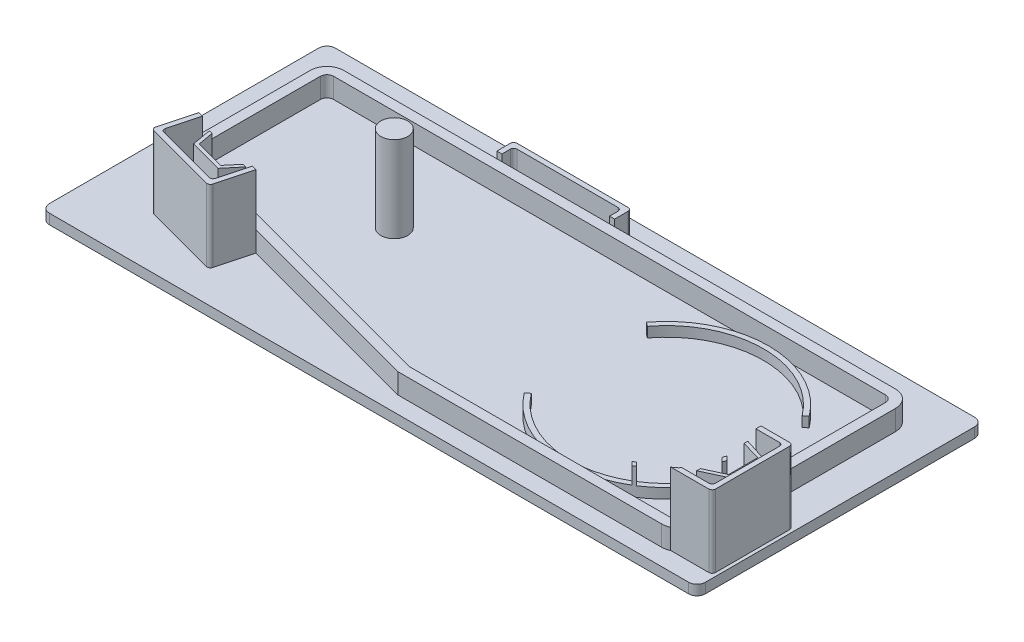
from build123d import *

# Parameters (mm, degrees)
SKETCH1_W           = 195
SKETCH1_H           = 85
BOSS_EXTRUDE1_DEPTH = 3
FILLET1_R           = 2.5
BOSS_EXTRUDE2_DEPTH = 6
BOSS_EXTRUDE3_DEPTH = 8
BOSS_EXTRUDE4_DEPTH = 19.5
BOSS_EXTRUDE5_DEPTH = 21.5
FILLET2_R           = 1
SKETCH7_R           = 4
BOSS_EXTRUDE6_DEPTH = 25.5
BOSS_EXTRUDE7_DEPTH = 3
BOSS_EXTRUDE8_DEPTH = 8


with BuildPart() as part:
    # Sketch1 → Boss-Extrude1 (new body)
    with BuildSketch(Plane(origin=(0, 0, 0), x_dir=(1, 0, 0), z_dir=(0, 1, 0))):
        Rectangle(SKETCH1_W, SKETCH1_H)
    extrude(amount=BOSS_EXTRUDE1_DEPTH)

    # Fillet1
    fillet1_edges = [part.edges().sort_by_distance(p)[0] for p in [
        (97.5, 1.5, 42.5),
        (-97.5, 1.5, 42.5),
        (-97.5, 1.5, -42.5),
        (97.5, 1.5, -42.5),
    ]]
    fillet(fillet1_edges, radius=FILLET1_R)

    # Sketch3 → Boss-Extrude2 (add)
    with BuildSketch(Plane(origin=(0, 3, 0), x_dir=(1, 0, 0), z_dir=(0, 1, 0))):
        with BuildLine():
            Line((82, -37.5), (4, -37.5))
            Line((4, -37.5), (3.605042507, -37.5))
            Line((3.605042507, -37.5), (-13.095926291, -33.024988898))
            Line((-13.095926291, -33.024988898), (-80.24005573, -15.033773638))
            Line((-80.24005573, -15.033773638), (-83.294095226, -14.215446222))
            ThreePointArc((-83.294095226, -14.215446222), (-85.966766701, -12.429624235), (-87, -9.38581709))
            Line((-87, -9.38581709), (-87, 27))
            ThreePointArc((-87, 27), (-85.535533906, 30.535533906), (-82, 32))
            Line((-82, 32), (-81.875932746, 32))
            Line((-81.875932746, 32), (82, 32))
            ThreePointArc((82, 32), (85.535533906, 30.535533906), (87, 27))
            Line((87, 27), (87, -32.5))
            ThreePointArc((87, -32.5), (85.535533906, -36.035533906), (82, -37.5))
        make_face()
        with BuildLine():
            Line((-84, -9.38581709), (-84, 27))
            ThreePointArc((-84, 27), (-83.414213562, 28.414213562), (-82, 29))
            Line((-82, 29), (82, 29))
            ThreePointArc((82, 29), (83.414213562, 28.414213562), (84, 27))
            Line((84, 27), (84, -32.5))
            ThreePointArc((84, -32.5), (83.414213562, -33.914213562), (82, -34.5))
            Line((82, -34.5), (4, -34.5))
            Line((4, -34.5), (-82.51763809, -11.317668743))
            ThreePointArc((-82.51763809, -11.317668743), (-83.586706681, -10.603339948), (-84, -9.38581709))
        make_face(mode=Mode.SUBTRACT)
    extrude(amount=BOSS_EXTRUDE2_DEPTH)

    # Sketch4 → Boss-Extrude3 (add)
    with BuildSketch(Plane(origin=(0, 3, 0), x_dir=(1, 0, 0), z_dir=(0, 1, 0))):
        Polygon((-35, 35.5), (-35, 32), (-36.5, 32), (-36.5, 37), (-3, 37), (-1.5, 37), (-1.5, 32), (-3, 32), (-3, 35.5), align=None)
    extrude(amount=BOSS_EXTRUDE3_DEPTH)

    # Sketch5 → Boss-Extrude4 (add)
    with BuildSketch(Plane(origin=(0, 3, 0), x_dir=(1, 0, 0), z_dir=(0, 1, 0))):
        Polygon((93.717571079, -28.970923081), (93.717571079, -19.029076919), (87.444515609, -17.040885435), (87, -16.9), (87, -18), (92.717571079, -19.66614718), (92.717571079, -28.33385282), (87, -31), (87, -32.103377919), (87.422618262, -31.906307787), align=None)
        Polygon((-71.878679656, -17.274197605), (-71.056906471, -21.934704933), (-62.363574034, -24.264076339), (-59.321643915, -20.638845191), (-58.255862687, -20.92442041), (-58.555599472, -21.281632801), (-62.007030461, -25.394888082), (-71.931088134, -22.735744843), (-72.863487409, -17.447845782), (-72.944460885, -16.988622385), align=None)
    extrude(amount=BOSS_EXTRUDE4_DEPTH)

    # Sketch6 → Boss-Extrude5 (add)
    with BuildSketch(Plane(origin=(0, 3, 0), x_dir=(1, 0, 0), z_dir=(0, 1, 0))):
        with BuildLine():
            Line((95, -35.5), (95, -14.5))
            Line((95, -14.5), (87, -14.5))
            Line((87, -14.5), (87, -13))
            Line((87, -13), (96.5, -13))
            Line((96.5, -13), (96.5, -37))
            Line((96.5, -37), (84.179449472, -37))
            ThreePointArc((84.179449472, -37), (85.179449472, -36.358898944), (86, -35.5))
            Line((86, -35.5), (95, -35.5))
        make_face()
        Polygon((-75.742382962, -16.238921424), (-78.330573413, -25.898179687), (-68.188352237, -28.615779661), (-58.046131061, -31.333379634), (-55.45794061, -21.674121371), (-54.00905187, -22.062349939), (-56.985470889, -33.170496941), (-68.576580804, -30.0646684), (-80.16769072, -26.958839859), (-77.191271701, -15.850692856), align=None)
    extrude(amount=BOSS_EXTRUDE5_DEPTH)

    # Fillet2
    fillet2_edges = [part.edges().sort_by_distance(p)[0] for p in [
        (-1.5, 7, -37),
        (-36.5, 7, -37),
        (-35, 7, -35.5),
        (-3, 7, -35.5),
        (95, 13.75, 14.5),
        (95, 13.75, 35.5),
        (96.5, 13.75, 37),
        (96.5, 13.75, 13),
        (-80.16769072, 13.75, 26.958839859),
        (-56.985470889, 13.75, 33.170496941),
        (-58.046131061, 13.75, 31.333379634),
        (-78.330573413, 13.75, 25.898179687),
    ]]
    fillet(fillet2_edges, radius=FILLET2_R)

    # Sketch7 → Boss-Extrude6 (add)
    with BuildSketch(Plane(origin=(0, 3, 0), x_dir=(1, 0, 0), z_dir=(0, 1, 0))):
        with Locations(Location((-40, 5, 0), (0, 0, 270))):
            Circle(SKETCH7_R)
    extrude(amount=BOSS_EXTRUDE6_DEPTH)

    # Sketch8 → Boss-Extrude7 (add)
    with BuildSketch(Plane(origin=(0, 3, 0), x_dir=(1, 0, 0), z_dir=(0, 1, 0))):
        with BuildLine():
            Line((24.8, 15.15), (26, 14.25))
            ThreePointArc((26, 14.25), (49, 25.75), (72, 14.25))
            Line((72, 14.25), (73.2, 15.15))
            ThreePointArc((73.2, 15.15), (49, 27.25), (24.8, 15.15))
        make_face()
        with BuildLine():
            Line((24.8, -21.15), (26, -20.25))
            ThreePointArc((26, -20.25), (49, -31.75), (72, -20.25))
            Line((72, -20.25), (73.2, -21.15))
            ThreePointArc((73.2, -21.15), (49, -33.25), (24.8, -21.15))
        make_face()
    extrude(amount=BOSS_EXTRUDE7_DEPTH)

    # Sketch9 → Boss-Extrude8 (add)
    with BuildSketch(Plane(origin=(0, 3, 0), x_dir=(1, 0, 0), z_dir=(0, 1, 0))):
        with BuildLine():
            Line((64.363989362, -27.300418327), (65.449871217, -28.386300182))
            ThreePointArc((65.449871217, -28.386300182), (65.016806514, -28.661730438), (64.579131266, -28.929773794))
            Line((64.579131266, -28.929773794), (63.484213314, -27.834855842))
            ThreePointArc((63.484213314, -27.834855842), (63.926493446, -27.571574907), (64.363989362, -27.300418327))
        make_face()
        with BuildLine():
            Line((76.19985084, -12.312927266), (77.373998096, -13.487074522))
            ThreePointArc((77.373998096, -13.487074522), (77.180097488, -13.997481782), (76.977016247, -14.504306235))
            Line((76.977016247, -14.504306235), (75.822470959, -13.349760947))
            ThreePointArc((75.822470959, -13.349760947), (76.016135348, -12.833154674), (76.19985084, -12.312927266))
        make_face()
    extrude(amount=BOSS_EXTRUDE8_DEPTH)


solid = part.part
